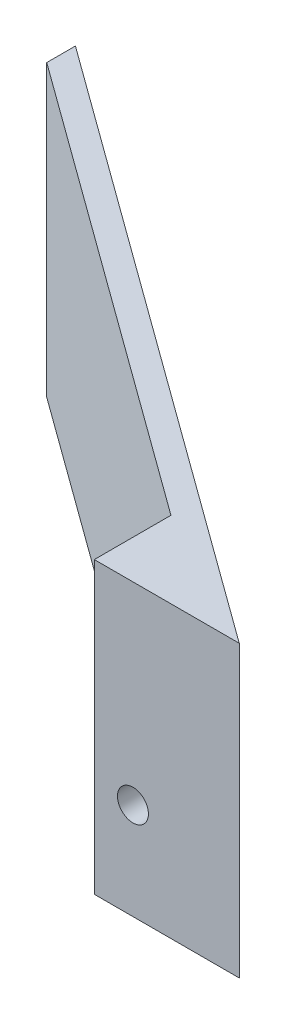
from build123d import *

# Parameters (mm, degrees)
EXTRUDE_1_DEPTH     = 30
SKETCH_2_R          = 1.6
CUT_EXTRUDE_1_DEPTH = 83.29890272
CUT_EXTRUDE_2_REACH = 82.696
SKETCH_3_R          = 3


with BuildPart() as part:
    # 草图1 → 凸台-拉伸1 (new body)
    with BuildSketch(Plane(origin=(0, 0, 0), x_dir=(1, 0, 0), z_dir=(0, 1, 0))):
        Polygon((0, 0), (-62, 45.045636736), (-62, 42.07907359), (-15, 7.931574774), (-15, 0), align=None)
    extrude(amount=EXTRUDE_1_DEPTH)

    # 草图2 → 切除-拉伸1 (cut, through all)
    with BuildSketch(Plane.XY):
        with Locations((-11, 10)):
            Circle(SKETCH_2_R)
    extrude(amount=-CUT_EXTRUDE_1_DEPTH, mode=Mode.SUBTRACT)

    # 切除-拉伸2: up to this plane
    cut_extrude_2_end = Plane(origin=(0, 30, 0), z_dir=(-0.5877852522924716, 0, 0.8090169943749486))
    # 草图3 → 切除-拉伸2 (cut, up to the surface)
    with BuildSketch(Plane.XY.offset(-3), mode=Mode.PRIVATE) as cut_extrude_2_sk1:
        with Locations((-11, 10)):
            Circle(SKETCH_3_R)
    cut_extrude_2_tool1 = split(extrude(cut_extrude_2_sk1.sketch, amount=-CUT_EXTRUDE_2_REACH, mode=Mode.PRIVATE), bisect_by=cut_extrude_2_end, keep=Keep.BOTH, mode=Mode.PRIVATE)
    add(cut_extrude_2_tool1.solids().sort_by_distance((-11, 10, -3))[0], mode=Mode.SUBTRACT)


solid = part.part
